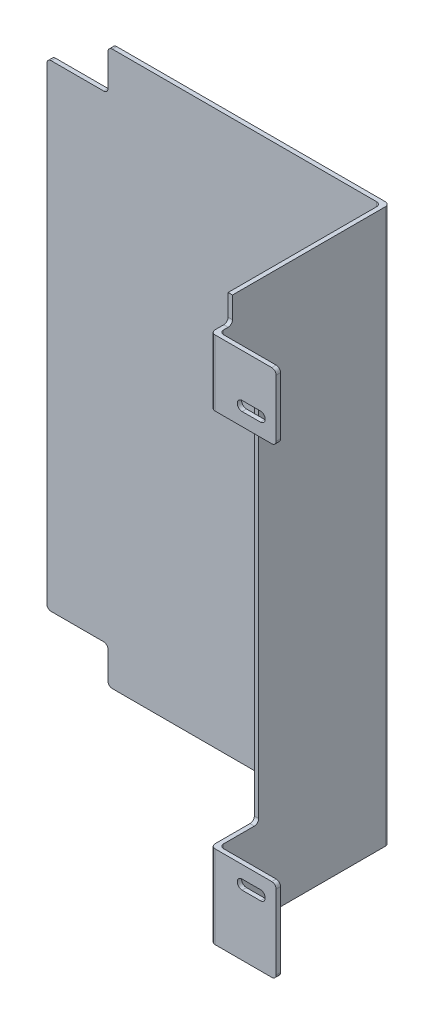
from build123d import *

# Parameters (mm, degrees)
SKETCH_1_W           = 77.5
SKETCH_1_H           = 127
EXTRUDE_1_DEPTH      = 1
SKETCH_3_W           = 1
SKETCH_3_H           = 127
EXTRUDE_3_DEPTH      = 39
SKETCH_8_W           = 15
SKETCH_8_H           = 127
EXTRUDE_4_DEPTH      = 1
SKETCH_21_W          = 14
SKETCH_21_H          = 8.4
SKETCH_21_H_2        = 9.4
CUT_EXTRUDE_6_DEPTH  = 10
SKETCH_23_W          = 103.043783305
SKETCH_23_H          = 23.177469884
SKETCH_23_W_2        = 105.258191256
SKETCH_23_H_2        = 21.258316326
CUT_EXTRUDE_7_DEPTH  = 100
SKETCH_24_W          = 15
SKETCH_24_H          = 86.8
CUT_EXTRUDE_8_DEPTH  = 10
SKETCH_25_W          = 15
SKETCH_25_H          = 6
CUT_EXTRUDE_9_DEPTH  = 4
CUT_EXTRUDE_10_DEPTH = 3
FILLET_4_R           = 1
SKETCH_27_W          = 6.001854857
SKETCH_27_H          = 0.706005101
SKETCH_27_W_2        = 0.785532112
SKETCH_27_H_2        = 5.586366798
SKETCH_27_W_3        = 0.26923077
SKETCH_27_H_3        = 3
SKETCH_27_W_4        = 0.269230769
CUT_EXTRUDE_11_DEPTH = 0.2


with BuildPart() as part:
    # 草图1 → 凸台-拉伸1 (new body)
    with BuildSketch(Plane.XY):
        with Locations((-106.368181818, 6.802865707)):
            Rectangle(SKETCH_1_W, SKETCH_1_H)
    extrude(amount=EXTRUDE_1_DEPTH)

    # 草图3 → 凸台-拉伸3 (add)
    with BuildSketch(Plane.XY.offset(1)):
        with Locations((-68.118181818, 6.802865707)):
            Rectangle(SKETCH_3_W, SKETCH_3_H)
    extrude(amount=EXTRUDE_3_DEPTH)

    # 草图8 → 凸台-拉伸4 (add)
    with BuildSketch(Plane.XY.offset(40)):
        with Locations((-61.118181818, 6.802865707)):
            Rectangle(SKETCH_8_W, SKETCH_8_H)
    extrude(amount=-EXTRUDE_4_DEPTH)

    # 草图21 → 切除-拉伸6 (cut)
    with BuildSketch(Plane(origin=(0, 0, 0), x_dir=(-1, 0, 0), z_dir=(0, 0, -1))):
        with Locations((138.118181818, -52.497134293)):
            Rectangle(SKETCH_21_W, SKETCH_21_H)
        with Locations((138.118181818, 65.602865707)):
            Rectangle(SKETCH_21_W, SKETCH_21_H_2)
    extrude(amount=-CUT_EXTRUDE_6_DEPTH, mode=Mode.SUBTRACT)

    # 草图23 → 切除-拉伸7 (cut)
    with BuildSketch(Plane(origin=(0, 0, 0), x_dir=(-1, 0, 0), z_dir=(0, 0, -1))):
        with Locations((104.846655458, -68.185869235)):
            Rectangle(SKETCH_23_W, SKETCH_23_H)
        with Locations((107.87301299, 80.83202387)):
            Rectangle(SKETCH_23_W_2, SKETCH_23_H_2)
    extrude(amount=-CUT_EXTRUDE_7_DEPTH, mode=Mode.SUBTRACT)

    # 草图24 → 切除-拉伸8 (cut)
    with BuildSketch(Plane.XY.offset(40)):
        with Locations((-61.118181818, 5.802865707)):
            Rectangle(SKETCH_24_W, SKETCH_24_H)
    extrude(amount=-CUT_EXTRUDE_8_DEPTH, mode=Mode.SUBTRACT)

    # 草图25 → 切除-拉伸9 (cut)
    with BuildSketch(Plane.XY.offset(40)):
        with Locations((-61.118181818, 67.302865707)):
            Rectangle(SKETCH_25_W, SKETCH_25_H)
    extrude(amount=-CUT_EXTRUDE_9_DEPTH, mode=Mode.SUBTRACT)

    # 草图26 → 切除-拉伸10 (cut)
    with BuildSketch(Plane(origin=(0, 0, 39), x_dir=(-1, 0, 0), z_dir=(0, 0, -1))):
        with BuildLine():
            Line((57.218181818, -40.497134293), (61.418181818, -40.497134293))
            ThreePointArc((61.418181818, -40.497134293), (62.518181818, -41.597134293), (61.418181818, -42.697134293))
            Line((61.418181818, -42.697134293), (57.218181818, -42.697134293))
            ThreePointArc((57.218181818, -42.697134293), (56.118181818, -41.597134293), (57.218181818, -40.497134293))
        make_face()
        with BuildLine():
            Line((57.218181818, 54.402865707), (61.418181818, 54.402865707))
            ThreePointArc((61.418181818, 54.402865707), (62.518181818, 53.302865707), (61.418181818, 52.202865707))
            Line((61.418181818, 52.202865707), (57.218181818, 52.202865707))
            ThreePointArc((57.218181818, 52.202865707), (56.118181818, 53.302865707), (57.218181818, 54.402865707))
        make_face()
    extrude(amount=-CUT_EXTRUDE_10_DEPTH, mode=Mode.SUBTRACT)

    # 圆角4
    fillet_4_edges = [part.edges().sort_by_distance(p)[0] for p in [
        (-53.618181818, -56.597134293, 39.5),
        (-53.618181818, 49.202865707, 39.5),
        (-53.618181818, -37.597134293, 39.5),
        (-67.618181818, -47.097134293, 39),
        (-68.618181818, -47.097134293, 40),
        (-68.118181818, -37.597134293, 30),
        (-68.118181818, 49.202865707, 30),
        (-53.618181818, 64.302865707, 39.5),
        (-67.618181818, 56.752865707, 39),
        (-68.618181818, 56.752865707, 40),
        (-68.118181818, 64.302865707, 36),
        (-145.118181818, -48.297134293, 0.5),
        (-131.118181818, -48.297134293, 0.5),
        (-145.118181818, 60.902865707, 0.5),
        (-131.118181818, 60.902865707, 0.5),
        (-131.118181818, -56.597134293, 0.5),
        (-131.118181818, 70.202865707, 0.5),
        (-68.618181818, 6.802865707, 1),
        (-67.618181818, 6.802865707, 0),
    ]]
    fillet(fillet_4_edges, radius=FILLET_4_R)

    # 草图27 → 切除-拉伸11 (cut)
    # profile 1 of 32: a face of its own
    with BuildSketch(Plane(origin=(0, 0, 0), x_dir=(-1, 0, 0), z_dir=(0, 0, -1))):
        with BuildLine():
            add(Edge.make_bspline(
                [(132.361810885, 6.932210097), (132.359718569, 6.836339908), (132.355567818, 6.646151987), (132.319557442, 6.36465751), (132.265765696, 6.088907514), (132.185210006, 5.821867786), (132.085678426, 5.562908953), (131.969075121, 5.31316953), (131.834613217, 5.072464954), (131.729598664, 4.92210297), (131.676904787, 4.846654799)],
                knots=[0, 0, 0, 0, 1.03058768, 2.044486723, 3.047426369, 4.048829226, 5.039629895, 6.028686707, 7.010840523, 8, 8, 8, 8], degree=3))
            Line((131.676904787, 4.846654799), (130.623577636, 4.846654799))
            add(Edge.make_bspline(
                [(130.623577636, 4.846654799), (130.699385171, 4.913654093), (130.849710902, 5.046513152), (131.04462651, 5.275246832), (131.214723968, 5.521414284), (131.357127515, 5.785965171), (131.47120739, 6.063667983), (131.549928523, 6.351615949), (131.601292479, 6.645267353), (131.607328865, 6.843813746), (131.610361777, 6.943571098)],
                knots=[0, 0, 0, 0, 1.013772945, 2.010303571, 3.005296295, 4.010536321, 5.018278058, 6.009712672, 7.000003016, 8, 8, 8, 8], degree=3))
            add(Edge.make_bspline(
                [(131.610361777, 6.943571098), (131.607549288, 7.036255633), (131.601993305, 7.219350978), (131.557763038, 7.489612377), (131.488854373, 7.752340535), (131.388603569, 8.004775564), (131.266498768, 8.246397747), (131.126139216, 8.47645509), (130.962128856, 8.688949348), (130.782542805, 8.88780058), (130.58337922, 9.06851012), (130.36789669, 9.230724171), (130.135327261, 9.373238687), (129.888280807, 9.49336745), (129.63078964, 9.594264394), (129.362645714, 9.663239723), (129.086963241, 9.707169181), (128.900117973, 9.712809056), (128.805817377, 9.715655494)],
                knots=[0, 0, 0, 0, 1.019271714, 2.013538798, 3.005469008, 4.002511789, 4.995441641, 5.981640173, 6.962633505, 7.944421105, 8.926208704, 9.916691219, 10.907960398, 11.922214128, 12.935908772, 13.945102014, 14.962895299, 16, 16, 16, 16], degree=3))
            add(Edge.make_bspline(
                [(128.805817377, 9.715655494), (128.711516035, 9.71281606), (128.524669292, 9.707190062), (128.248479575, 9.663075543), (127.979311809, 9.594158538), (127.720794677, 9.494228591), (127.4741149, 9.372291631), (127.240428428, 9.230919636), (127.023276966, 9.06806135), (126.821190187, 8.887800365), (126.637985395, 8.690034931), (126.474491083, 8.475856448), (126.331958251, 8.246894392), (126.209739121, 8.005072818), (126.111843883, 7.7519752), (126.042384186, 7.48965928), (125.99831304, 7.219338896), (125.992735417, 7.036251572), (125.989911974, 6.943571098)],
                knots=[0, 0, 0, 0, 1.034925094, 2.050579359, 3.063398465, 4.080510706, 5.087302685, 6.081558313, 7.074713255, 8.063256922, 9.051015066, 10.029946716, 11.017204657, 12.008047742, 13.000847364, 13.990692908, 14.982870414, 16, 16, 16, 16], degree=3))
            add(Edge.make_bspline(
                [(125.989911974, 6.943571098), (125.9926493, 6.843766722), (125.998102423, 6.64494289), (126.053981519, 6.351520374), (126.135185779, 6.063116405), (126.254872412, 5.786145096), (126.400246789, 5.522053011), (126.570180718, 5.276535319), (126.759761443, 5.048011016), (126.904282833, 4.913867958), (126.976696115, 4.846654799)],
                knots=[0, 0, 0, 0, 1.002243855, 1.996605469, 2.993240355, 4.009509462, 5.022221091, 6.019449441, 7.007633632, 8, 8, 8, 8], degree=3))
            Line((126.976696115, 4.846654799), (125.944467968, 4.846654799))
            add(Edge.make_bspline(
                [(125.944467968, 4.846654799), (125.891702232, 4.922068299), (125.78654447, 5.072361188), (125.652928723, 5.31398849), (125.531976378, 5.562361938), (125.43146796, 5.821885798), (125.34906144, 6.088814519), (125.293825194, 6.364607779), (125.255630195, 6.646036635), (125.251769361, 6.836323622), (125.249823869, 6.932210097)],
                knots=[0, 0, 0, 0, 0.987846152, 1.968695945, 2.961417013, 3.952998205, 4.95474104, 5.95751121, 6.97078065, 8, 8, 8, 8], degree=3))
            add(Edge.make_bspline(
                [(125.249823869, 6.932210097), (125.253325603, 7.052493022), (125.260251814, 7.290405066), (125.313360978, 7.641446831), (125.401777623, 7.981067813), (125.52305817, 8.308484564), (125.676628316, 8.619103955), (125.852470981, 8.912967981), (126.057314361, 9.182631968), (126.282992233, 9.432884716), (126.534298857, 9.658094862), (126.805437761, 9.862248193), (127.100004155, 10.039743658), (127.413824592, 10.191658625), (127.744087149, 10.315982503), (128.088079027, 10.40318144), (128.443279405, 10.456838288), (128.683903073, 10.463652245), (128.805817377, 10.467104602)],
                knots=[0, 0, 0, 0, 1.036567134, 2.050264442, 3.052428786, 4.057291306, 5.054233742, 6.035576434, 7.004653534, 7.968656631, 8.936116541, 9.908923092, 10.890265784, 11.89559352, 12.910823657, 13.926535674, 14.949459281, 16, 16, 16, 16], degree=3))
            add(Edge.make_bspline(
                [(128.805817377, 10.467104602), (128.927731716, 10.463652284), (129.168355454, 10.456838405), (129.523555314, 10.403180985), (129.867549137, 10.315984196), (130.197804462, 10.191652334), (130.511651422, 10.03976665), (130.806121588, 9.862164943), (131.07729294, 9.658643175), (131.327028145, 9.432300233), (131.552776373, 9.18271239), (131.757485885, 8.912933599), (131.9335257, 8.619160981), (132.086513675, 8.308117472), (132.210323549, 7.981444061), (132.298135244, 7.641394922), (132.351418654, 7.290418449), (132.358321143, 7.052497516), (132.361810885, 6.932210097)],
                knots=[0, 0, 0, 0, 1.0506605, 2.07370074, 3.089528567, 4.10487446, 5.110316822, 6.091771406, 7.064688875, 8.028801887, 8.992914898, 9.96210249, 10.943557074, 11.940613181, 12.947223179, 13.949501789, 14.963314678, 16, 16, 16, 16], degree=3))
        make_face()
    # profile 2 of 32: a face of its own
    with BuildSketch(Plane(origin=(0, 0, 0), x_dir=(-1, 0, 0), z_dir=(0, 0, -1))):
        with BuildLine():
            add(Edge.make_bspline(
                [(128.805817377, 3.398938592), (128.70455715, 3.401686356), (128.504117503, 3.40712542), (128.207895303, 3.442810221), (127.920712656, 3.504982439), (127.643132715, 3.591494233), (127.374783006, 3.699013024), (127.116030519, 3.825986126), (126.866638047, 3.972285682), (126.708708672, 4.083273049), (126.629374066, 4.139026698)],
                knots=[0, 0, 0, 0, 1.039063368, 2.05677492, 3.056337236, 4.050179329, 5.036722986, 6.019887094, 7.005305522, 8, 8, 8, 8], degree=3))
            Line((126.629374066, 4.139026698), (130.982260687, 4.139026698))
            add(Edge.make_bspline(
                [(130.982260687, 4.139026698), (130.906256466, 4.083190237), (130.754328162, 3.97157619), (130.511199561, 3.82533091), (130.255940785, 3.698748729), (129.989156135, 3.591275167), (129.710550094, 3.504285402), (129.419382518, 3.442757124), (129.116163137, 3.406991851), (128.910324416, 3.401650478), (128.805817377, 3.398938592)],
                knots=[0, 0, 0, 0, 0.966144402, 1.931270101, 2.903251329, 3.883405307, 4.875994212, 5.890560788, 6.929009833, 8, 8, 8, 8], degree=3))
        make_face()
    # profile 3 of 32: a face of its own
    with BuildSketch(Plane(origin=(0, 0, 0), x_dir=(-1, 0, 0), z_dir=(0, 0, -1))):
        Polygon((115.209944434, 10.433021597), (117.800252804, 5.047906828), (119.247969011, 8.110508265), (120.716784221, 5.047906828), (123.251910583, 10.433021597), (124.116969707, 10.433021597), (121.490955332, 4.846654799), (119.932875109, 4.846654799), (119.247969011, 6.271649002), (118.585784917, 4.846654799), (117.037442695, 4.846654799), (114.344885311, 10.433021597), align=None)
    # profile 4 of 32: a face of its own
    with BuildSketch(Plane(origin=(0, 0, 0), x_dir=(-1, 0, 0), z_dir=(0, 0, -1))):
        Polygon((121.154994284, 4.139026698), (120.716784221, 3.220408567), (120.280197159, 4.139026698), align=None)
    # profile 5 of 32: a face of its own
    with BuildSketch(Plane(origin=(0, 0, 0), x_dir=(-1, 0, 0), z_dir=(0, 0, -1))):
        Polygon((118.249823869, 4.139026698), (117.822974808, 3.220408567), (117.384764745, 4.139026698), align=None)
    # profile 6 of 32: a face of its own
    with BuildSketch(Plane(origin=(0, 0, 0), x_dir=(-1, 0, 0), z_dir=(0, 0, -1))):
        Polygon((113.137373138, 9.727016496), (110.534080766, 9.727016496), (110.534080766, 4.846654799), (109.748548654, 4.846654799), (109.748548654, 9.727016496), (107.135518281, 9.727016496), (107.135518281, 10.433021597), (113.137373138, 10.433021597), align=None)
    # profile 7 of 32: a face of its own
    with BuildSketch(Plane(origin=(0, 0, 0), x_dir=(-1, 0, 0), z_dir=(0, 0, -1))):
        with Locations((110.13644571, 3.786024148)):
            Rectangle(SKETCH_27_W, SKETCH_27_H)
    # profile 8 of 32: a face of its own
    with BuildSketch(Plane(origin=(0, 0, 0), x_dir=(-1, 0, 0), z_dir=(0, 0, -1))):
        Polygon((100.330278309, 10.433021597), (104.301759876, 4.846654799), (103.324713736, 4.846654799), (99.880707244, 9.770837502), (99.880707244, 4.846654799), (99.095175132, 4.846654799), (99.095175132, 10.433021597), align=None)
    # profile 9 of 32: a face of its own
    with BuildSketch(Plane(origin=(0, 0, 0), x_dir=(-1, 0, 0), z_dir=(0, 0, -1))):
        with Locations((105.231739009, 7.639838198)):
            Rectangle(SKETCH_27_W_2, SKETCH_27_H_2)
    # profile 10 of 32: a face of its own
    with BuildSketch(Plane(origin=(0, 0, 0), x_dir=(-1, 0, 0), z_dir=(0, 0, -1))):
        Polygon((104.838972953, 4.08384469), (104.838972953, 4.139026698), (105.624505065, 4.139026698), (105.624505065, 3.433021597), (104.311497877, 3.433021597), (103.818105807, 4.139026698), (104.806512948, 4.139026698), align=None)
    # profile 11 of 32: a face of its own
    with BuildSketch(Plane(origin=(0, 0, 0), x_dir=(-1, 0, 0), z_dir=(0, 0, -1))):
        with Locations((99.487941188, 3.786024148)):
            Rectangle(SKETCH_27_W_2, SKETCH_27_H)
    # profile 12 of 32: a face of its own
    with BuildSketch(Plane(origin=(0, 0, 0), x_dir=(-1, 0, 0), z_dir=(0, 0, -1))):
        Polygon((97.556570912, 9.727016496), (94.95327854, 9.727016496), (94.95327854, 4.846654799), (94.167746428, 4.846654799), (94.167746428, 9.727016496), (91.554716055, 9.727016496), (91.554716055, 10.433021597), (97.556570912, 10.433021597), align=None)
    # profile 13 of 32: a face of its own
    with BuildSketch(Plane(origin=(0, 0, 0), x_dir=(-1, 0, 0), z_dir=(0, 0, -1))):
        with Locations((94.555643484, 3.786024148)):
            Rectangle(SKETCH_27_W, SKETCH_27_H)
    # profile 14 of 32: a face of its own
    with BuildSketch(Plane(origin=(0, 0, 0), x_dir=(-1, 0, 0), z_dir=(0, 0, -1))):
        with BuildLine():
            Line((90.020980836, 9.727016496), (85.994317261, 9.727016496))
            add(Edge.make_bspline(
                [(85.994317261, 9.727016496), (85.945576825, 9.72625712), (85.850512015, 9.724776009), (85.712549163, 9.708222612), (85.583926713, 9.681593338), (85.465480103, 9.641084442), (85.355032309, 9.593946195), (85.254760611, 9.532994577), (85.165124676, 9.460606096), (85.057128742, 9.352836519), (84.94525472, 9.19632099), (84.850445097, 8.982540351), (84.7922934, 8.744900982), (84.785471749, 8.578275364), (84.781936087, 8.49191332)],
                knots=[0, 0, 0, 0, 0.894045037, 1.743772317, 2.546064088, 3.299570562, 4.037479179, 4.745807551, 5.44510245, 6.147140658, 7.541353896, 8.94560581, 10.416907733, 12, 12, 12, 12], degree=3))
            add(Edge.make_bspline(
                [(84.781936087, 8.49191332), (84.784032021, 8.416502013), (84.788061702, 8.271514829), (84.829869685, 8.064329463), (84.895940611, 7.877181014), (84.989085047, 7.709554436), (85.113625242, 7.564591985), (85.275189633, 7.45270016), (85.464252575, 7.362008469), (85.605484997, 7.330249075), (85.679455216, 7.313615151)],
                knots=[0, 0, 0, 0, 1.107947277, 2.130160098, 3.094221819, 4.017106281, 4.936381347, 5.877172391, 6.888172984, 8, 8, 8, 8], degree=3))
            Line((85.679455216, 7.313615151), (85.679455216, 6.573527046))
            add(Edge.make_bspline(
                [(85.679455216, 6.573527046), (85.622543696, 6.575448459), (85.509050909, 6.579280137), (85.341320369, 6.608626639), (85.179228691, 6.660610344), (85.022401178, 6.728151146), (84.872577444, 6.813068094), (84.732644282, 6.912508963), (84.598796611, 7.021180888), (84.478283769, 7.14565549), (84.364461129, 7.279212063), (84.268905283, 7.429068024), (84.178927269, 7.586150307), (84.107422178, 7.756630252), (84.048924659, 7.934051444), (84.006779724, 8.117096942), (83.979586671, 8.303366862), (83.976732205, 8.4290645), (83.975304972, 8.49191332)],
                knots=[0, 0, 0, 0, 0.962596373, 1.919606864, 2.869103692, 3.836561256, 4.803802322, 5.776312143, 6.738429753, 7.715708597, 8.703601777, 9.701241016, 10.717350462, 11.762918456, 12.822256561, 13.874612732, 14.937306366, 16, 16, 16, 16], degree=3))
            add(Edge.make_bspline(
                [(83.975304972, 8.49191332), (83.976444975, 8.563441871), (83.978682234, 8.703816945), (84.008549485, 8.908170731), (84.049097403, 9.103943415), (84.111364856, 9.28777383), (84.188054428, 9.460745127), (84.276514264, 9.620529374), (84.376877072, 9.76740041), (84.488879651, 9.900628868), (84.612179746, 10.020242297), (84.744476013, 10.127501893), (84.887703817, 10.217868025), (85.03933139, 10.29441864), (85.197733684, 10.356649228), (85.362367686, 10.399452143), (85.530675358, 10.429398942), (85.644698597, 10.431807469), (85.702177219, 10.433021597)],
                knots=[0, 0, 0, 0, 1.184646847, 2.324874281, 3.417261675, 4.494935235, 5.534817173, 6.550479279, 7.518127336, 8.479228562, 9.430530745, 10.36192561, 11.297370225, 12.231868599, 13.17450773, 14.11209934, 15.04831744, 16, 16, 16, 16], degree=3))
            Line((85.702177219, 10.433021597), (90.020980836, 10.433021597))
            Line((90.020980836, 10.433021597), (90.020980836, 9.727016496))
        make_face()
    # profile 15 of 32: a face of its own
    with BuildSketch(Plane(origin=(0, 0, 0), x_dir=(-1, 0, 0), z_dir=(0, 0, -1))):
        with BuildLine():
            Line((84.087291988, 4.139026698), (89.774284801, 4.139026698))
            add(Edge.make_bspline(
                [(89.774284801, 4.139026698), (89.733909994, 4.084941776), (89.654135185, 3.978077752), (89.512684931, 3.837259685), (89.355708697, 3.717305196), (89.186957628, 3.614550025), (89.006413889, 3.532300151), (88.814382507, 3.476648987), (88.613711511, 3.438653622), (88.476065983, 3.434919693), (88.406095605, 3.433021597)],
                knots=[0, 0, 0, 0, 1.010118382, 1.99584856, 2.978241117, 3.963738029, 4.950434005, 5.940220839, 6.9529371, 8, 8, 8, 8], degree=3))
            Line((88.406095605, 3.433021597), (84.087291988, 3.433021597))
            Line((84.087291988, 3.433021597), (84.087291988, 4.139026698))
        make_face()
    # profile 16 of 32: a face of its own
    with BuildSketch(Plane(origin=(0, 0, 0), x_dir=(-1, 0, 0), z_dir=(0, 0, -1))):
        with BuildLine():
            add(Edge.make_bspline(
                [(90.132967852, 5.374129874), (90.132191424, 5.329214522), (90.130637387, 5.239315451), (90.12284396, 5.105484611), (90.108221471, 4.973707976), (90.087856045, 4.888692736), (90.077785844, 4.846654799)],
                knots=[0, 0, 0, 0, 1.013661509, 2.028865938, 3.025322871, 4, 4, 4, 4], degree=3))
            Line((90.077785844, 4.846654799), (89.246809725, 4.846654799))
            add(Edge.make_bspline(
                [(89.246809725, 4.846654799), (89.258863289, 4.882703075), (89.284249692, 4.958625526), (89.309875101, 5.083132937), (89.323799615, 5.223405516), (89.325461953, 5.322161083), (89.326336737, 5.374129874)],
                knots=[0, 0, 0, 0, 0.850057133, 1.790333072, 2.837192447, 4, 4, 4, 4], degree=3))
            add(Edge.make_bspline(
                [(89.326336737, 5.374129874), (89.324192686, 5.449533117), (89.320055387, 5.595036094), (89.278654989, 5.802839746), (89.21192419, 5.991657513), (89.117836713, 6.160126396), (88.994352253, 6.308181063), (88.83405828, 6.423439685), (88.643906712, 6.513590513), (88.502748802, 6.545469489), (88.428817608, 6.562166044)],
                knots=[0, 0, 0, 0, 1.103013834, 2.128446887, 3.088215855, 4.024683736, 4.940688048, 5.886624871, 6.893123703, 8, 8, 8, 8], degree=3))
            Line((88.428817608, 6.562166044), (88.428817608, 7.292516148))
            add(Edge.make_bspline(
                [(88.428817608, 7.292516148), (88.486285264, 7.290681637), (88.5998167, 7.28705743), (88.76788218, 7.256848291), (88.929843918, 7.206159169), (89.086296275, 7.137525644), (89.235100163, 7.052708657), (89.376726837, 6.955502049), (89.508805094, 6.844608654), (89.630287426, 6.720643621), (89.742946812, 6.586424388), (89.841620225, 6.439697541), (89.928850884, 6.282586802), (90.00098775, 6.114396833), (90.059546213, 5.937997695), (90.101648487, 5.754919355), (90.128822978, 5.566460883), (90.131578424, 5.4386023), (90.132967852, 5.374129874)],
                knots=[0, 0, 0, 0, 0.971398133, 1.919066005, 2.876969733, 3.835703325, 4.80260982, 5.769559602, 6.737201732, 7.714142532, 8.701693997, 9.696466754, 10.699786402, 11.736589288, 12.786869172, 13.83886133, 14.910250314, 16, 16, 16, 16], degree=3))
        make_face()
    # profile 17 of 32: a face of its own
    with BuildSketch(Plane(origin=(0, 0, 0), x_dir=(-1, 0, 0), z_dir=(0, 0, -1))):
        with BuildLine():
            add(Edge.make_bspline(
                [(131.212811437, 24.895309635), (131.157255587, 24.896692945), (131.048139313, 24.899409878), (130.887920707, 24.920893799), (130.734504939, 24.956255053), (130.587800378, 25.006189306), (130.448377592, 25.070934976), (130.315795786, 25.149537674), (130.190510681, 25.242769907), (130.072846316, 25.348418505), (129.965900787, 25.464548388), (129.872840846, 25.589221997), (129.793638157, 25.719930003), (129.728926729, 25.857523622), (129.678078726, 26.00138854), (129.643010884, 26.15238179), (129.620605219, 26.309500688), (129.617986192, 26.416666727), (129.616657591, 26.471030789)],
                knots=[0, 0, 0, 0, 1.065027606, 2.091802087, 3.093458616, 4.079833113, 5.057734272, 6.036020118, 7.030157768, 8.047461502, 9.064242947, 10.052216774, 11.02588392, 11.989864716, 12.962978571, 13.945936472, 14.957997893, 16, 16, 16, 16], degree=3))
            add(Edge.make_bspline(
                [(129.616657591, 26.471030789), (129.617986637, 26.524994082), (129.620606341, 26.631361982), (129.643029089, 26.787488278), (129.678235111, 26.937553743), (129.728297692, 27.081209345), (129.793056787, 27.218525619), (129.872384102, 27.349325077), (129.965234965, 27.474362221), (130.071742013, 27.591057416), (130.18804858, 27.69801281), (130.311951923, 27.792562987), (130.443302528, 27.871328705), (130.580050334, 27.937007513), (130.723556285, 27.986750437), (130.872808271, 28.022999007), (131.028652562, 28.045178868), (131.134813824, 28.047815602), (131.188772976, 28.049155789)],
                knots=[0, 0, 0, 0, 1.043683505, 2.0572211, 3.045299494, 4.022276905, 4.994977706, 5.977452478, 6.97747046, 8.003698437, 9.029677512, 10.031249186, 11.013723958, 11.988083691, 12.9614021, 13.946617861, 14.956316495, 16, 16, 16, 16], degree=3))
            add(Edge.make_bspline(
                [(131.188772976, 28.049155789), (131.243136784, 28.047827922), (131.350302322, 28.045210341), (131.507618256, 28.022766581), (131.658719055, 27.987683407), (131.80313948, 27.937498179), (131.940926925, 27.872883834), (132.072068062, 27.793482398), (132.196720481, 27.699918712), (132.313615696, 27.593495304), (132.42044212, 27.477411762), (132.514402129, 27.353671106), (132.593345799, 27.223450182), (132.657987421, 27.087285783), (132.709116483, 26.945529873), (132.744009558, 26.797290753), (132.766582355, 26.643399088), (132.769183772, 26.538619552), (132.770503745, 26.485453866)],
                knots=[0, 0, 0, 0, 1.053167129, 2.076072758, 3.073341244, 4.055601477, 5.033424535, 6.017524495, 7.021518915, 8.049444456, 9.077120685, 10.074910483, 11.055688766, 12.022980584, 12.991883888, 13.970269434, 14.970104079, 16, 16, 16, 16], degree=3))
            add(Edge.make_bspline(
                [(132.770503745, 26.485453866), (132.770045906, 26.449768558), (132.769136005, 26.378848128), (132.758165514, 26.273536299), (132.742278657, 26.169906742), (132.719391202, 26.068307808), (132.689868327, 25.968722907), (132.653486393, 25.871355696), (132.611792682, 25.775404155), (132.562150559, 25.682694411), (132.507989518, 25.593080952), (132.448932345, 25.507684317), (132.384567264, 25.428029922), (132.315813718, 25.352837848), (132.241720001, 25.283391453), (132.163401224, 25.218176646), (132.080447585, 25.157868506), (131.992727892, 25.103733671), (131.902478591, 25.054010167), (131.809044921, 25.012495133), (131.714398236, 24.97580141), (131.617704852, 24.946640782), (131.519188437, 24.92343458), (131.418725835, 24.907666552), (131.31642052, 24.896671685), (131.247496391, 24.895765605), (131.212811437, 24.895309635)],
                knots=[0, 0, 0, 0, 1.037115869, 2.061148057, 3.07517727, 4.084041727, 5.086514338, 6.092668487, 7.104487461, 8.125783165, 9.147610153, 10.147694368, 11.141876323, 12.122903372, 13.107606018, 14.091946891, 15.084523921, 16.086505767, 17.087268121, 18.077809654, 19.05670789, 20.036870126, 21.011670792, 21.99694167, 22.991993299, 24, 24, 24, 24], degree=3))
        make_face()
        with BuildLine():
            add(Edge.make_bspline(
                [(131.199590284, 25.203001943), (131.228060399, 25.203347615), (131.284728453, 25.204035655), (131.368965993, 25.213155193), (131.452125838, 25.226047036), (131.534025288, 25.244818438), (131.614737584, 25.268870538), (131.694352316, 25.298571439), (131.772940579, 25.333245229), (131.849783724, 25.373493706), (131.923654536, 25.418608071), (131.994996876, 25.466173591), (132.061086094, 25.518886214), (132.123198724, 25.574791167), (132.181184074, 25.634658182), (132.23504989, 25.698046243), (132.284743104, 25.765242324), (132.329668065, 25.83596645), (132.369647648, 25.909824675), (132.405443079, 25.9854049), (132.435116117, 26.063595416), (132.458621586, 26.143908274), (132.478572343, 26.225989557), (132.491086935, 26.310286472), (132.500293847, 26.396508419), (132.500944087, 26.454778911), (132.501272976, 26.484251943)],
                knots=[0, 0, 0, 0, 1.008431664, 2.007222653, 2.999229743, 3.989431819, 4.982149843, 5.98167215, 6.998687425, 8.024288174, 9.053028776, 10.065052016, 11.06063401, 12.045759335, 13.024701188, 14.011819507, 14.991481775, 15.984022113, 16.97831254, 17.965966747, 18.945551853, 19.938269878, 20.93007375, 21.936103907, 22.956087853, 24, 24, 24, 24], degree=3))
            add(Edge.make_bspline(
                [(132.501272976, 26.484251943), (132.500177737, 26.527590004), (132.498023063, 26.612849377), (132.47923796, 26.737807559), (132.450072231, 26.85801458), (132.407787434, 26.972753959), (132.353844832, 27.082537351), (132.288045808, 27.186937518), (132.209787782, 27.285923664), (132.120945822, 27.378758935), (132.023799481, 27.463459632), (131.920693806, 27.53791199), (131.81244453, 27.60057317), (131.699675575, 27.652956509), (131.581424139, 27.692419937), (131.458448404, 27.720557343), (131.330745653, 27.738793996), (131.243723629, 27.740565209), (131.199590284, 27.741463482)],
                knots=[0, 0, 0, 0, 1.032022337, 2.030307203, 3.003823408, 3.974715386, 4.937372378, 5.913284036, 6.909147208, 7.938749767, 8.970518239, 9.975863271, 10.963918693, 11.946286286, 12.933361397, 13.927862637, 14.949112547, 16, 16, 16, 16], degree=3))
            add(Edge.make_bspline(
                [(131.199590284, 27.741463482), (131.169924879, 27.741056236), (131.111089472, 27.740248547), (131.023580747, 27.732101988), (130.937640385, 27.71906425), (130.85342745, 27.70019953), (130.77083058, 27.676902996), (130.690102807, 27.648001551), (130.611256675, 27.613372366), (130.533958246, 27.574717364), (130.4598818, 27.53112177), (130.389868559, 27.483220897), (130.323458101, 27.432297329), (130.261458843, 27.376797236), (130.203715571, 27.317435229), (130.150812459, 27.253778982), (130.101142415, 27.187086283), (130.05653255, 27.116380133), (130.016004525, 27.043106324), (129.981260635, 26.967306075), (129.951570546, 26.88945948), (129.9276416, 26.809489716), (129.908879993, 26.727581918), (129.895955064, 26.643617444), (129.886913352, 26.557766689), (129.886231883, 26.499700512), (129.88588836, 26.470429828)],
                knots=[0, 0, 0, 0, 1.047362266, 2.077233941, 3.100744636, 4.115120168, 5.122788643, 6.129711893, 7.140355774, 8.162227187, 9.180148637, 10.17298275, 11.156396779, 12.133377858, 13.108923632, 14.078087502, 15.054351192, 16.043448276, 17.028082865, 18.009331763, 18.985518559, 19.968016174, 20.954783108, 21.950335389, 22.966780876, 24, 24, 24, 24], degree=3))
            add(Edge.make_bspline(
                [(129.88588836, 26.470429828), (129.886232172, 26.441359396), (129.886914184, 26.383692838), (129.895950591, 26.298440708), (129.908894211, 26.215080813), (129.927547961, 26.13394041), (129.951590949, 26.054998816), (129.981237236, 25.97833018), (130.016196052, 25.903648852), (130.056317433, 25.831139522), (130.101416539, 25.761560923), (130.150697955, 25.695045504), (130.205008734, 25.632836809), (130.26281136, 25.573420118), (130.32549552, 25.517983839), (130.393072206, 25.466742355), (130.46385865, 25.417386181), (130.539456392, 25.37370751), (130.617193849, 25.333160454), (130.697042929, 25.298596376), (130.778005123, 25.268738611), (130.860188568, 25.244922026), (130.943451295, 25.226028801), (131.027816441, 25.213159864), (131.11325268, 25.204034675), (131.170719756, 25.20334728), (131.199590284, 25.203001943)],
                knots=[0, 0, 0, 0, 1.02988216, 2.042960975, 3.035124439, 4.018561492, 4.99104521, 5.957523397, 6.929462691, 7.91146347, 8.892205782, 9.866320947, 10.842813644, 11.816825305, 12.802668543, 13.805243666, 14.821427616, 15.858893029, 16.897256944, 17.927432741, 18.940436917, 19.95373962, 20.957947499, 21.96413624, 22.977215056, 24, 24, 24, 24], degree=3))
        make_face(mode=Mode.SUBTRACT)
    # profile 18 of 32: a face of its own
    with BuildSketch(Plane(origin=(0, 0, 0), x_dir=(-1, 0, 0), z_dir=(0, 0, -1))):
        Polygon((129.347426822, 25.27992502), (129.347426822, 24.972232712), (127.770503745, 24.972232712), (127.770503745, 25.27992502), (128.424349899, 25.27992502), (128.424349899, 27.972232712), (128.693580668, 27.972232712), (128.693580668, 25.27992502), align=None)
    # profile 19 of 32: a face of its own
    with BuildSketch(Plane(origin=(0, 0, 0), x_dir=(-1, 0, 0), z_dir=(0, 0, -1))):
        Polygon((126.001272976, 24.972232712), (124.616657591, 27.972232712), (124.90932586, 27.972232712), (125.352835476, 27.010694251), (126.712811437, 27.010694251), (127.168941245, 27.972232712), (127.462811437, 27.972232712), (126.039734514, 24.972232712), align=None)
        Polygon((126.023508553, 25.556968289), (126.566777784, 26.703001943), (125.494662399, 26.703001943), align=None, mode=Mode.SUBTRACT)
    # profile 20 of 32: a face of its own
    with BuildSketch(Plane(origin=(0, 0, 0), x_dir=(-1, 0, 0), z_dir=(0, 0, -1))):
        Polygon((124.15511913, 24.972232712), (123.88588836, 24.972232712), (123.88588836, 26.114660597), (122.635287399, 24.972232712), (122.251272976, 24.972232712), (123.72543163, 26.318386559), (122.13588836, 27.972232712), (122.494662399, 27.972232712), (123.88588836, 26.524516366), (123.88588836, 27.972232712), (124.15511913, 27.972232712), align=None)
    # profile 21 of 32: a face of its own
    with BuildSketch(Plane(origin=(0, 0, 0), x_dir=(-1, 0, 0), z_dir=(0, 0, -1))):
        with BuildLine():
            Line((121.693580668, 24.972232712), (121.424349899, 24.972232712))
            Line((121.424349899, 24.972232712), (121.424349899, 26.769708674))
            add(Edge.make_bspline(
                [(121.424349899, 26.769708674), (121.424389965, 26.795149305), (121.424465998, 26.843427285), (121.423958129, 26.912142972), (121.422535813, 26.973233651), (121.421639105, 27.026934806), (121.419644248, 27.073000018), (121.41801735, 27.111678856), (121.415925444, 27.142788172), (121.413411344, 27.160943251), (121.412330668, 27.168747135)],
                knots=[0, 0, 0, 0, 1.528628734, 2.90083645, 4.128790002, 5.200304208, 6.127813768, 6.898992206, 7.526736466, 8, 8, 8, 8], degree=3))
            add(Edge.make_bspline(
                [(121.412330668, 27.168747135), (121.407947757, 27.197119864), (121.399486745, 27.251892141), (121.376926154, 27.329792169), (121.347095115, 27.400371878), (121.309078064, 27.464419852), (121.262188917, 27.522386418), (121.204337017, 27.574828884), (121.135641768, 27.621898332), (121.05766517, 27.663186604), (120.974529654, 27.697430243), (120.889277469, 27.72306588), (120.803537157, 27.738752059), (120.746127598, 27.740563804), (120.71761913, 27.741463482)],
                knots=[0, 0, 0, 0, 1.042923073, 2.013316119, 2.939979093, 3.821796737, 4.712412725, 5.640305549, 6.650442997, 7.732186751, 8.842579391, 9.91407549, 10.964170509, 12, 12, 12, 12], degree=3))
            add(Edge.make_bspline(
                [(120.71761913, 27.741463482), (120.693142299, 27.740548192), (120.644330009, 27.738722898), (120.571842919, 27.72727921), (120.501018377, 27.707065733), (120.43242805, 27.679516369), (120.367129754, 27.645692021), (120.306879075, 27.604890662), (120.252310511, 27.558056887), (120.203099882, 27.505410102), (120.160266537, 27.446627691), (120.123393516, 27.382015913), (120.093266306, 27.311059431), (120.078131472, 27.261053312), (120.070383553, 27.235453866)],
                knots=[0, 0, 0, 0, 0.994543961, 1.983343699, 2.972712664, 3.980751554, 4.981834161, 5.954730495, 6.930176574, 7.89761099, 8.875938748, 9.87834379, 10.913868493, 12, 12, 12, 12], degree=3))
            add(Edge.make_bspline(
                [(120.070383553, 27.235453866), (120.067812017, 27.224869374), (120.062081598, 27.20128286), (120.056726988, 27.161407468), (120.051149967, 27.114359441), (120.047280335, 27.059800745), (120.043507861, 26.997914197), (120.041250941, 26.928377405), (120.04020777, 26.851442867), (120.039896901, 26.797753871), (120.039734514, 26.769708674)],
                knots=[0, 0, 0, 0, 0.558680831, 1.244966039, 2.062412453, 2.990489873, 4.051219941, 5.244515665, 6.560634259, 8, 8, 8, 8], degree=3))
            Line((120.039734514, 26.769708674), (120.039734514, 24.972232712))
            Line((120.039734514, 24.972232712), (119.770503745, 24.972232712))
            Line((119.770503745, 24.972232712), (119.770503745, 26.784131751))
            add(Edge.make_bspline(
                [(119.770503745, 26.784131751), (119.770719185, 26.81678785), (119.771139629, 26.880518213), (119.774858866, 26.97390029), (119.780619612, 27.062505524), (119.789321624, 27.146222454), (119.798950326, 27.225145295), (119.81261039, 27.298984974), (119.827137487, 27.368367911), (119.845368795, 27.433422083), (119.867055953, 27.495129073), (119.892882248, 27.554654402), (119.924337207, 27.611462509), (119.959942203, 27.66659479), (120.00042622, 27.719543161), (120.045444059, 27.770718493), (120.095716248, 27.819448017), (120.149975783, 27.8659647), (120.207782133, 27.90953137), (120.269783832, 27.946624815), (120.334871036, 27.978017562), (120.402353455, 28.00475556), (120.473371643, 28.024307779), (120.547040995, 28.038987271), (120.623879264, 28.047291495), (120.67613404, 28.04852909), (120.702595091, 28.049155789)],
                knots=[0, 0, 0, 0, 1.316485072, 2.56920066, 3.767172097, 4.895413872, 5.962239305, 6.971350037, 7.921780903, 8.819233545, 9.69278517, 10.557066787, 11.431700348, 12.307563454, 13.200791052, 14.11626757, 15.05287325, 16.020813301, 16.99640464, 17.967304965, 18.928075993, 19.907403966, 20.889159767, 21.893313923, 22.933205135, 24, 24, 24, 24], degree=3))
            add(Edge.make_bspline(
                [(120.702595091, 28.049155789), (120.731454533, 28.0484836), (120.788076654, 28.047164766), (120.871506298, 28.039595806), (120.951500774, 28.025375527), (121.028840808, 28.007151547), (121.102779209, 27.982427686), (121.173294187, 27.952048656), (121.241195402, 27.917366378), (121.304953056, 27.876383798), (121.365090172, 27.831695053), (121.419741061, 27.782609366), (121.47029304, 27.730996173), (121.51451789, 27.674911976), (121.554088342, 27.615504871), (121.588132441, 27.552495438), (121.617375133, 27.485968145), (121.6324661, 27.439722179), (121.640095091, 27.416343289)],
                knots=[0, 0, 0, 0, 1.138939089, 2.234594419, 3.301501784, 4.342532435, 5.367382236, 6.373123747, 7.370098489, 8.372230273, 9.360297234, 10.323289009, 11.268038109, 12.20748145, 13.137029304, 14.081414587, 15.030090602, 16, 16, 16, 16], degree=3))
            add(Edge.make_bspline(
                [(121.640095091, 27.416343289), (121.644532655, 27.400372511), (121.654157831, 27.365731538), (121.664465229, 27.308400262), (121.673130156, 27.242387475), (121.681277777, 27.16768866), (121.686085456, 27.084245917), (121.690300403, 26.992095418), (121.693610362, 26.891125736), (121.693590843, 26.820793294), (121.693580668, 26.784131751)],
                knots=[0, 0, 0, 0, 0.625038921, 1.35572334, 2.194682327, 3.136881307, 4.189498639, 5.346923369, 6.617055217, 8, 8, 8, 8], degree=3))
            Line((121.693580668, 26.784131751), (121.693580668, 24.972232712))
        make_face()
    # profile 22 of 32: a face of its own
    with BuildSketch(Plane(origin=(0, 0, 0), x_dir=(-1, 0, 0), z_dir=(0, 0, -1))):
        Polygon((132.770503745, 33.933771174), (132.374470091, 30.933771174), (132.336008553, 30.933771174), (131.097426822, 33.395309635), (129.861849899, 30.933771174), (129.822787399, 30.933771174), (129.424349899, 33.933771174), (129.694782591, 33.933771174), (129.982042207, 31.775117328), (131.064974899, 33.933771174), (131.125672014, 33.933771174), (132.212811437, 31.770309635), (132.499470091, 33.933771174), align=None)
    # profile 23 of 32: a face of its own
    with BuildSketch(Plane(origin=(0, 0, 0), x_dir=(-1, 0, 0), z_dir=(0, 0, -1))):
        with Locations((128.674349899, 32.433771174)):
            Rectangle(SKETCH_27_W_3, SKETCH_27_H_3)
    # profile 24 of 32: a face of its own
    with BuildSketch(Plane(origin=(0, 0, 0), x_dir=(-1, 0, 0), z_dir=(0, 0, -1))):
        Polygon((127.88588836, 33.933771174), (127.88588836, 30.933771174), (127.829397976, 30.933771174), (125.847426822, 33.294949059), (125.847426822, 30.933771174), (125.578196053, 30.933771174), (125.578196053, 33.933771174), (125.63949413, 33.933771174), (127.616657591, 31.578001943), (127.616657591, 33.933771174), align=None)
    # profile 25 of 32: a face of its own
    with BuildSketch(Plane(origin=(0, 0, 0), x_dir=(-1, 0, 0), z_dir=(0, 0, -1))):
        with Locations((124.674349899, 32.433771174)):
            Rectangle(SKETCH_27_W_3, SKETCH_27_H_3)
    # profile 26 of 32: a face of its own
    with BuildSketch(Plane(origin=(0, 0, 0), x_dir=(-1, 0, 0), z_dir=(0, 0, -1))):
        with BuildLine():
            Line((132.924349899, 39.316583674), (132.67074413, 39.164540405))
            add(Edge.make_bspline(
                [(132.67074413, 39.164540405), (132.647157069, 39.204024163), (132.601965172, 39.279673521), (132.526578292, 39.381894698), (132.448464368, 39.468776547), (132.36704494, 39.539813639), (132.282816984, 39.595741256), (132.195230652, 39.635343169), (132.1045811, 39.660042577), (132.042889253, 39.663042651), (132.012090284, 39.664540405)],
                knots=[0, 0, 0, 0, 1.272034388, 2.437168799, 3.508375237, 4.49857839, 5.41946034, 6.295179144, 7.148887113, 8, 8, 8, 8], degree=3))
            add(Edge.make_bspline(
                [(132.012090284, 39.664540405), (131.985792583, 39.663790401), (131.933657329, 39.662303516), (131.856755455, 39.648593673), (131.782441867, 39.626164471), (131.71145619, 39.595759001), (131.645675793, 39.558384985), (131.587076704, 39.514310794), (131.537564541, 39.463396023), (131.496631411, 39.407476448), (131.464588279, 39.347719338), (131.441788828, 39.285596352), (131.427142954, 39.221503353), (131.425286067, 39.17803962), (131.424349899, 39.156126943)],
                knots=[0, 0, 0, 0, 1.095645842, 2.172120455, 3.244862764, 4.326153987, 5.384857088, 6.392105572, 7.372507978, 8.334705661, 9.272564127, 10.189475455, 11.087205874, 12, 12, 12, 12], degree=3))
            add(Edge.make_bspline(
                [(131.424349899, 39.156126943), (131.425586452, 39.131140735), (131.428090608, 39.080540939), (131.450159897, 39.005759153), (131.483858778, 38.931434357), (131.515531939, 38.885451024), (131.531922014, 38.861655789)],
                knots=[0, 0, 0, 0, 0.938992559, 1.901562324, 2.914110574, 4, 4, 4, 4], degree=3))
            add(Edge.make_bspline(
                [(131.531922014, 38.861655789), (131.54531397, 38.844435494), (131.573511232, 38.808177519), (131.622700318, 38.755154051), (131.678631409, 38.699011986), (131.74275258, 38.640871907), (131.814128808, 38.579544516), (131.893569297, 38.516167202), (131.980146456, 38.449794717), (132.041211847, 38.4059576), (132.072787399, 38.383290405)],
                knots=[0, 0, 0, 0, 0.722283655, 1.520795216, 2.39349503, 3.346893347, 4.386874146, 5.510198126, 6.712579003, 8, 8, 8, 8], degree=3))
            add(Edge.make_bspline(
                [(132.072787399, 38.383290405), (132.104346614, 38.360803612), (132.16468543, 38.317810578), (132.249132931, 38.254084859), (132.324546339, 38.195450157), (132.391309924, 38.14272323), (132.447696428, 38.093604399), (132.495767182, 38.050726158), (132.533748676, 38.011798857), (132.554884482, 37.986566311), (132.564373937, 37.97523752)],
                knots=[0, 0, 0, 0, 1.452255772, 2.776602448, 3.96446981, 5.032613149, 5.964194703, 6.766668629, 7.446264616, 8, 8, 8, 8], degree=3))
            add(Edge.make_bspline(
                [(132.564373937, 37.97523752), (132.577633896, 37.957578612), (132.603711385, 37.922849999), (132.638171065, 37.868584041), (132.667231008, 37.813139681), (132.690618828, 37.756315979), (132.709531672, 37.698539996), (132.722680951, 37.639377975), (132.730785889, 37.579231542), (132.731623105, 37.538764228), (132.732042207, 37.518506751)],
                knots=[0, 0, 0, 0, 1.068019517, 2.100403715, 3.106014851, 4.09224787, 5.069873182, 6.043214339, 7.020455327, 8, 8, 8, 8], degree=3))
            add(Edge.make_bspline(
                [(132.732042207, 37.518506751), (132.730928386, 37.486764225), (132.728724552, 37.423957646), (132.709932583, 37.332256391), (132.680622172, 37.244434783), (132.638216725, 37.162447415), (132.585838065, 37.086410509), (132.523664495, 37.017672895), (132.450531681, 36.958600605), (132.369116183, 36.908384437), (132.281041395, 36.868323135), (132.188479957, 36.83913196), (132.091847792, 36.82202415), (132.026179815, 36.819611003), (131.992859514, 36.818386559)],
                knots=[0, 0, 0, 0, 1.005367131, 1.989245246, 2.955191616, 3.932180104, 4.904534562, 5.875498653, 6.859376768, 7.874484044, 8.900379497, 9.918679785, 10.943926428, 12, 12, 12, 12], degree=3))
            add(Edge.make_bspline(
                [(131.992859514, 36.818386559), (131.957496503, 36.819566587), (131.887367423, 36.821906726), (131.784180689, 36.843505015), (131.684239682, 36.877063118), (131.604144809, 36.917030172), (131.541435711, 36.956517558), (131.493663571, 36.992575465), (131.444989461, 37.033997248), (131.395937825, 37.081660412), (131.346024021, 37.134610388), (131.295478082, 37.193295774), (131.243826951, 37.25718761), (131.210609509, 37.302810562), (131.193580668, 37.326199059)],
                knots=[0, 0, 0, 0, 1.286534051, 2.551350862, 3.822568981, 5.117864672, 5.799956111, 6.519305446, 7.295594771, 8.126302591, 9.008831062, 9.944975596, 10.946496709, 12, 12, 12, 12], degree=3))
            Line((131.193580668, 37.326199059), (131.436970091, 37.510694251))
            add(Edge.make_bspline(
                [(131.436970091, 37.510694251), (131.451665533, 37.491759991), (131.479965518, 37.455297035), (131.522947905, 37.404250489), (131.563398441, 37.357558378), (131.603557009, 37.317109406), (131.640328058, 37.279874146), (131.676650767, 37.248561569), (131.711121937, 37.222177598), (131.754473271, 37.193984068), (131.809529587, 37.166706619), (131.877997313, 37.143254515), (131.949595254, 37.128841806), (131.998201515, 37.12700997), (132.022907591, 37.126078866)],
                knots=[0, 0, 0, 0, 1.181426797, 2.275151783, 3.28963443, 4.225459815, 5.084396437, 5.868484344, 6.587427557, 7.222918358, 8.415355282, 9.605213164, 10.782753814, 12, 12, 12, 12], degree=3))
            add(Edge.make_bspline(
                [(132.022907591, 37.126078866), (132.05390621, 37.12710046), (132.113684125, 37.129070506), (132.198353546, 37.151152541), (132.275000501, 37.184726787), (132.340699006, 37.233140499), (132.394945242, 37.29085897), (132.434671839, 37.35668282), (132.458423673, 37.429382702), (132.461330856, 37.480071545), (132.462811437, 37.505886559)],
                knots=[0, 0, 0, 0, 1.144248881, 2.206576175, 3.214949548, 4.222996039, 5.203671638, 6.127710127, 7.046472867, 8, 8, 8, 8], degree=3))
            add(Edge.make_bspline(
                [(132.462811437, 37.505886559), (132.462439299, 37.521951345), (132.461689837, 37.554304707), (132.452754431, 37.602006333), (132.439420211, 37.6491464), (132.420519322, 37.695996504), (132.394832791, 37.743891365), (132.359945972, 37.79255799), (132.316289738, 37.843214379), (132.282784728, 37.876128884), (132.265095091, 37.893506751)],
                knots=[0, 0, 0, 0, 0.858500039, 1.728959331, 2.587258638, 3.476905708, 4.426389682, 5.487945037, 6.673710648, 8, 8, 8, 8], degree=3))
            add(Edge.make_bspline(
                [(132.265095091, 37.893506751), (132.258528201, 37.899367059), (132.242926772, 37.913289809), (132.21440455, 37.936083192), (132.176739294, 37.964199854), (132.13091455, 37.998988982), (132.076085383, 38.039344521), (132.012245763, 38.084750475), (131.940107307, 38.136680868), (131.888917093, 38.172987332), (131.861849899, 38.192184635)],
                knots=[0, 0, 0, 0, 0.420754252, 0.999615792, 1.744751191, 2.668019286, 3.750313428, 4.999500688, 6.413464383, 8, 8, 8, 8], degree=3))
            add(Edge.make_bspline(
                [(131.861849899, 38.192184635), (131.829290568, 38.215877246), (131.766243935, 38.261754703), (131.676537128, 38.330682202), (131.595200642, 38.398095351), (131.521942893, 38.463559267), (131.456060303, 38.526592019), (131.398217006, 38.58790308), (131.348150553, 38.64709038), (131.293514337, 38.72245617), (131.238347955, 38.815874824), (131.191047316, 38.930381889), (131.16095546, 39.045217552), (131.157047358, 39.122301183), (131.15511913, 39.160333674)],
                knots=[0, 0, 0, 0, 1.163604038, 2.253157948, 3.268574773, 4.215621239, 5.091738613, 5.902582348, 6.650434646, 7.330118262, 8.591011492, 9.77460283, 10.902005569, 12, 12, 12, 12], degree=3))
            add(Edge.make_bspline(
                [(131.15511913, 39.160333674), (131.155683278, 39.187228918), (131.15680062, 39.24049712), (131.169611358, 39.318722985), (131.188447625, 39.39466542), (131.216520815, 39.467379356), (131.251613118, 39.537675195), (131.294337716, 39.605429682), (131.346115064, 39.669529538), (131.403633486, 39.731219601), (131.4675219, 39.787012164), (131.535128886, 39.836705723), (131.606074982, 39.879254457), (131.681170381, 39.912681688), (131.759178055, 39.939420614), (131.840464179, 39.958586373), (131.925203422, 39.970389265), (131.982804668, 39.97161137), (132.012090284, 39.972232712)],
                knots=[0, 0, 0, 0, 0.98378539, 1.948466333, 2.894822735, 3.844243623, 4.795447569, 5.768042124, 6.770299647, 7.807997672, 8.852593179, 9.870666288, 10.876941106, 11.874841786, 12.874492863, 13.892063892, 14.928283473, 16, 16, 16, 16], degree=3))
            add(Edge.make_bspline(
                [(132.012090284, 39.972232712), (132.034748149, 39.971789536), (132.079778527, 39.970908765), (132.146205126, 39.963306653), (132.211411926, 39.952158059), (132.274580199, 39.935160507), (132.336496429, 39.914052195), (132.396608989, 39.888208314), (132.455062888, 39.85744176), (132.511930333, 39.821704944), (132.567731822, 39.780508785), (132.622242147, 39.732943479), (132.675734185, 39.679236701), (132.728430136, 39.61946319), (132.77908868, 39.552634933), (132.828983727, 39.479811746), (132.877855474, 39.400758367), (132.908562284, 39.345165974), (132.924349899, 39.316583674)],
                knots=[0, 0, 0, 0, 0.915366252, 1.81920441, 2.69897508, 3.586533125, 4.459536084, 5.340758185, 6.227946952, 7.126403341, 8.052553006, 9.028121456, 10.047063623, 11.114014537, 12.24582441, 13.433687931, 14.680555077, 16, 16, 16, 16], degree=3))
        make_face()
    # profile 27 of 32: a face of its own
    with BuildSketch(Plane(origin=(0, 0, 0), x_dir=(-1, 0, 0), z_dir=(0, 0, -1))):
        Polygon((130.539734514, 36.895309635), (128.847426822, 36.895309635), (128.847426822, 37.203001943), (130.270503745, 37.203001943), (130.270503745, 38.126078866), (128.847426822, 38.126078866), (128.847426822, 38.433771174), (130.270503745, 38.433771174), (130.270503745, 39.587617328), (128.847426822, 39.587617328), (128.847426822, 39.895309635), (130.539734514, 39.895309635), align=None)
    # profile 28 of 32: a face of its own
    with BuildSketch(Plane(origin=(0, 0, 0), x_dir=(-1, 0, 0), z_dir=(0, 0, -1))):
        with BuildLine():
            Line((128.308965284, 36.895309635), (127.708604707, 36.895309635))
            add(Edge.make_bspline(
                [(127.708604707, 36.895309635), (127.668540882, 36.895442995), (127.591613901, 36.89569906), (127.481408241, 36.897126857), (127.381270729, 36.901219161), (127.291253724, 36.904740804), (127.211358877, 36.911162468), (127.141341199, 36.917300166), (127.081523173, 36.925334732), (127.045312443, 36.932796523), (127.028917207, 36.93617502)],
                knots=[0, 0, 0, 0, 1.410062039, 2.707475311, 3.878576406, 4.937260626, 5.877586885, 6.699081471, 7.410979367, 8, 8, 8, 8], degree=3))
            add(Edge.make_bspline(
                [(127.028917207, 36.93617502), (127.006968302, 36.941597361), (126.963538723, 36.952326371), (126.901015456, 36.97501474), (126.84141197, 37.001227993), (126.784946533, 37.032251591), (126.731633943, 37.067561663), (126.681479569, 37.107300155), (126.635155885, 37.151807546), (126.591014764, 37.199240165), (126.552471133, 37.251663169), (126.517771641, 37.30641623), (126.488642606, 37.364553481), (126.465721307, 37.42578169), (126.44650571, 37.489500241), (126.433591035, 37.556338758), (126.425547549, 37.626079783), (126.424752853, 37.673532314), (126.424349899, 37.697593289)],
                knots=[0, 0, 0, 0, 1.027276577, 2.032638556, 3.019345632, 3.985365262, 4.957888996, 5.923693931, 6.890056973, 7.876427719, 8.865527834, 9.843495157, 10.821038291, 11.815616373, 12.812734995, 13.843357168, 14.906466538, 16, 16, 16, 16], degree=3))
            add(Edge.make_bspline(
                [(126.424349899, 37.697593289), (126.425609008, 37.737566282), (126.428065854, 37.815563944), (126.450973543, 37.928758343), (126.488494605, 38.034351534), (126.54020643, 38.132196567), (126.606028937, 38.220437727), (126.685132621, 38.297680675), (126.777113507, 38.362915863), (126.863143697, 38.407672952), (126.939174312, 38.436471581), (127.001951172, 38.456836123), (127.070482112, 38.472304961), (127.143783953, 38.486363972), (127.222422885, 38.497092127), (127.306240548, 38.504711157), (127.395446576, 38.509610251), (127.456594943, 38.510326029), (127.488051822, 38.510694251)],
                knots=[0, 0, 0, 0, 1.260402266, 2.459371274, 3.627181936, 4.786749125, 5.93865593, 7.087644312, 8.261344208, 9.485713728, 10.136162886, 10.825977872, 11.566646758, 12.35154167, 13.181268117, 14.0701832, 15.007234106, 16, 16, 16, 16], degree=3))
            Line((127.488051822, 38.510694251), (126.38588836, 39.895309635))
            Line((126.38588836, 39.895309635), (126.718821053, 39.895309635))
            Line((126.718821053, 39.895309635), (127.820984514, 38.510694251))
            Line((127.820984514, 38.510694251), (128.039734514, 38.510694251))
            Line((128.039734514, 38.510694251), (128.039734514, 39.895309635))
            Line((128.039734514, 39.895309635), (128.308965284, 39.895309635))
            Line((128.308965284, 39.895309635), (128.308965284, 36.895309635))
        make_face()
        with BuildLine():
            Line((128.039734514, 37.203001943), (128.039734514, 38.203001943))
            Line((128.039734514, 38.203001943), (127.490455668, 38.207208674))
            add(Edge.make_bspline(
                [(127.490455668, 38.207208674), (127.464809917, 38.207220026), (127.415101148, 38.20724203), (127.343186336, 38.203818705), (127.276226091, 38.199924732), (127.214477372, 38.193967149), (127.157909817, 38.186293806), (127.10656079, 38.176680517), (127.060316816, 38.165528004), (127.006554552, 38.148090188), (126.945829986, 38.121654359), (126.881196854, 38.080663309), (126.824677031, 38.031090676), (126.777687039, 37.973688227), (126.739944624, 37.910304061), (126.713729155, 37.842372653), (126.696453313, 37.770964332), (126.694549256, 37.721933947), (126.693580668, 37.696992328)],
                knots=[0, 0, 0, 0, 1.146399208, 2.222048177, 3.218135709, 4.144938032, 4.994811973, 5.769438708, 6.479732432, 7.119818093, 8.294689872, 9.430121864, 10.527913442, 11.641375077, 12.733452768, 13.811150417, 14.886538365, 16, 16, 16, 16], degree=3))
            add(Edge.make_bspline(
                [(126.693580668, 37.696992328), (126.6945983, 37.672861975), (126.696614874, 37.625044421), (126.713454086, 37.555198306), (126.740949852, 37.488783819), (126.778584499, 37.426714865), (126.825424853, 37.37078986), (126.879983317, 37.323085752), (126.940976007, 37.283454538), (126.9975202, 37.257305767), (127.048429887, 37.241919789), (127.092428351, 37.230751125), (127.142576299, 37.222929098), (127.198283496, 37.215734924), (127.259794659, 37.20964256), (127.327147273, 37.205598749), (127.40029318, 37.203181757), (127.450990536, 37.203063276), (127.477234514, 37.203001943)],
                knots=[0, 0, 0, 0, 1.100596872, 2.180981401, 3.259506136, 4.371595435, 5.481727359, 6.576991111, 7.667816242, 8.793363246, 9.406619729, 10.09427138, 10.864108636, 11.721733836, 12.6590937, 13.685439239, 14.801845161, 16, 16, 16, 16], degree=3))
            Line((127.477234514, 37.203001943), (128.039734514, 37.203001943))
        make_face(mode=Mode.SUBTRACT)
    # profile 29 of 32: a face of its own
    with BuildSketch(Plane(origin=(0, 0, 0), x_dir=(-1, 0, 0), z_dir=(0, 0, -1))):
        Polygon((126.001272976, 36.895309635), (125.712811437, 36.895309635), (124.712811437, 39.259492328), (123.712811437, 36.895309635), (123.424349899, 36.895309635), (124.693580668, 39.895309635), (124.732042207, 39.895309635), align=None)
    # profile 30 of 32: a face of its own
    with BuildSketch(Plane(origin=(0, 0, 0), x_dir=(-1, 0, 0), z_dir=(0, 0, -1))):
        with Locations((122.712811438, 38.395309635)):
            Rectangle(SKETCH_27_W_4, SKETCH_27_H_3)
    # profile 31 of 32: a face of its own
    with BuildSketch(Plane(origin=(0, 0, 0), x_dir=(-1, 0, 0), z_dir=(0, 0, -1))):
        with BuildLine():
            Line((119.15511913, 37.445790405), (119.390696053, 37.626078866))
            add(Edge.make_bspline(
                [(119.390696053, 37.626078866), (119.407501272, 37.606051157), (119.44088514, 37.566265756), (119.494590496, 37.510393682), (119.550572804, 37.458066591), (119.608754172, 37.408948276), (119.670481051, 37.365012902), (119.733401473, 37.322838746), (119.799801616, 37.285913821), (119.891154071, 37.240805406), (120.011124634, 37.194761113), (120.161625927, 37.155159046), (120.318950915, 37.130186894), (120.426259041, 37.127463894), (120.480840284, 37.126078866)],
                knots=[0, 0, 0, 0, 0.75789156, 1.505565099, 2.245254514, 2.979266606, 3.711207489, 4.440978832, 5.174393176, 5.91211879, 7.394186119, 8.890401545, 10.418332761, 12, 12, 12, 12], degree=3))
            add(Edge.make_bspline(
                [(120.480840284, 37.126078866), (120.510911317, 37.126426682), (120.570774298, 37.127119086), (120.659621241, 37.136189565), (120.746977412, 37.149085053), (120.832517964, 37.16775395), (120.916073054, 37.192059159), (120.998278879, 37.220562685), (121.078167296, 37.256032417), (121.156699656, 37.295204051), (121.2319357, 37.33946061), (121.303136121, 37.387718501), (121.369979796, 37.439500994), (121.432636721, 37.494685722), (121.490475531, 37.553916925), (121.544110673, 37.616529107), (121.593473689, 37.682805028), (121.638513647, 37.752428019), (121.678799049, 37.825054163), (121.713733038, 37.900371499), (121.743262512, 37.978092294), (121.767218686, 38.058049984), (121.785967767, 38.139961538), (121.798946123, 38.224120244), (121.807933035, 38.310378997), (121.808619338, 38.368843943), (121.808965284, 38.398314443)],
                knots=[0, 0, 0, 0, 1.054960097, 2.100129169, 3.131228542, 4.15308236, 5.169990287, 6.183953224, 7.204064171, 8.235355279, 9.262684623, 10.264978336, 11.252191258, 12.228402777, 13.192898315, 14.155264692, 15.119862721, 16.091023151, 17.063429752, 18.032246104, 19.00241354, 19.978852882, 20.959535218, 21.948948728, 22.966123959, 24, 24, 24, 24], degree=3))
            add(Edge.make_bspline(
                [(121.808965284, 38.398314443), (121.807881188, 38.442654586), (121.805752711, 38.529710575), (121.78689014, 38.657242273), (121.757996377, 38.779535009), (121.715401484, 38.895760749), (121.661831649, 39.006888377), (121.594991265, 39.111570241), (121.517285399, 39.211339963), (121.427916886, 39.303781177), (121.329852165, 39.388220319), (121.224640357, 39.462578277), (121.112539357, 39.524562378), (120.994788008, 39.576141783), (120.870479897, 39.615790401), (120.739838642, 39.643702508), (120.603148359, 39.661910091), (120.509746016, 39.663653252), (120.462210476, 39.664540405)],
                knots=[0, 0, 0, 0, 1.029159485, 2.020618137, 2.987588728, 3.942669054, 4.889339625, 5.846988364, 6.821327795, 7.821533711, 8.827683044, 9.822769455, 10.807800696, 11.797391277, 12.803701919, 13.832062008, 14.896664671, 16, 16, 16, 16], degree=3))
            add(Edge.make_bspline(
                [(120.462210476, 39.664540405), (120.409836742, 39.663092879), (120.306752706, 39.660243803), (120.155580112, 39.636107303), (120.010863742, 39.596971945), (119.87259581, 39.542202298), (119.741166114, 39.471003479), (119.616368976, 39.384691013), (119.498099059, 39.282443871), (119.426980817, 39.204372618), (119.390696053, 39.164540405)],
                knots=[0, 0, 0, 0, 1.028121516, 2.023589091, 2.998037872, 3.967518031, 4.937445131, 5.927275754, 6.942489185, 8, 8, 8, 8], degree=3))
            Line((119.390696053, 39.164540405), (119.15511913, 39.343025982))
            add(Edge.make_bspline(
                [(119.15511913, 39.343025982), (119.174078149, 39.367486707), (119.211905376, 39.416290993), (119.273145618, 39.485107251), (119.337704454, 39.549780407), (119.405756163, 39.609973647), (119.477389582, 39.665987837), (119.552573403, 39.717562523), (119.630932635, 39.765269823), (119.712565396, 39.808510885), (119.797476155, 39.846988208), (119.884937244, 39.8806173), (119.975108877, 39.908855408), (120.067279976, 39.932581264), (120.162397598, 39.949526058), (120.259373432, 39.96301152), (120.359110383, 39.971013877), (120.426338947, 39.971822789), (120.460407591, 39.972232712)],
                knots=[0, 0, 0, 0, 0.986880684, 1.969034265, 2.935876267, 3.899990983, 4.864973347, 5.834408638, 6.8063673, 7.789580233, 8.778939794, 9.778051223, 10.776304221, 11.791326552, 12.811423977, 13.855999788, 14.91350973, 16, 16, 16, 16], degree=3))
            add(Edge.make_bspline(
                [(120.460407591, 39.972232712), (120.492673592, 39.972008147), (120.556475612, 39.971564098), (120.650674542, 39.964370811), (120.742379897, 39.954556751), (120.831329576, 39.939779496), (120.918008983, 39.92234149), (121.001632341, 39.898966127), (121.083022522, 39.872781127), (121.161852528, 39.842005425), (121.238189413, 39.807277268), (121.311786966, 39.76802736), (121.382611337, 39.724585762), (121.45135884, 39.677910039), (121.517013912, 39.626500923), (121.580145505, 39.571072379), (121.641107628, 39.511811227), (121.678824215, 39.469078496), (121.697787399, 39.447593289)],
                knots=[0, 0, 0, 0, 1.114604814, 2.203992996, 3.262667896, 4.300477797, 5.318619304, 6.316056647, 7.298880507, 8.271930387, 9.238335007, 10.195173496, 11.151986948, 12.108099108, 13.064862484, 14.031167946, 15.010108607, 16, 16, 16, 16], degree=3))
            add(Edge.make_bspline(
                [(121.697787399, 39.447593289), (121.728158827, 39.4102715), (121.788535011, 39.336078504), (121.865814766, 39.215844713), (121.931745263, 39.090422231), (121.985647563, 38.95908459), (122.027050819, 38.821780732), (122.056159999, 38.67873154), (122.074944108, 38.530222975), (122.077100133, 38.429221437), (122.078196053, 38.377881751)],
                knots=[0, 0, 0, 0, 0.994611881, 1.977215934, 2.950189954, 3.921972279, 4.908960509, 5.911694611, 6.938501887, 8, 8, 8, 8], degree=3))
            add(Edge.make_bspline(
                [(122.078196053, 38.377881751), (122.076857067, 38.323922191), (122.074222698, 38.217760126), (122.052025684, 38.061921658), (122.015884659, 37.912832229), (121.966118226, 37.769918178), (121.900462995, 37.633997206), (121.820982028, 37.50449526), (121.726898988, 37.381518084), (121.619395468, 37.266637951), (121.501474398, 37.161607019), (121.375202753, 37.06920097), (121.240817798, 36.992300435), (121.099802612, 36.928017958), (120.951100568, 36.878608432), (120.795029117, 36.844019982), (120.631881474, 36.822491027), (120.520570823, 36.81976942), (120.46401336, 36.818386559)],
                knots=[0, 0, 0, 0, 1.032901378, 2.032168977, 3.007206631, 3.966850309, 4.924221947, 5.891988639, 6.871730993, 7.884084801, 8.900290346, 9.89161143, 10.874607481, 11.860025555, 12.854717796, 13.869097222, 14.917278314, 16, 16, 16, 16], degree=3))
            add(Edge.make_bspline(
                [(120.46401336, 36.818386559), (120.429543859, 36.818799871), (120.361314951, 36.81961798), (120.260383446, 36.827593938), (120.162121023, 36.840894019), (120.066254331, 36.859019821), (119.972625243, 36.881564834), (119.881654535, 36.909794168), (119.793602865, 36.9439253), (119.707876496, 36.981912404), (119.625574587, 37.025417894), (119.546738074, 37.072706405), (119.472007097, 37.124688555), (119.400895867, 37.1806062), (119.333733153, 37.240889508), (119.269510982, 37.304525195), (119.21013625, 37.373201321), (119.17349174, 37.421549751), (119.15511913, 37.445790405)],
                knots=[0, 0, 0, 0, 1.096566765, 2.170543479, 3.218870886, 4.250164525, 5.273529809, 6.281496242, 7.278154839, 8.276706968, 9.263143576, 10.238168486, 11.199979644, 12.157579042, 13.114563119, 14.070017788, 15.032356758, 16, 16, 16, 16], degree=3))
        make_face()
    # profile 32 of 32: a face of its own
    with BuildSketch(Plane(origin=(0, 0, 0), x_dir=(-1, 0, 0), z_dir=(0, 0, -1))):
        Polygon((118.539734514, 36.895309635), (116.847426822, 36.895309635), (116.847426822, 37.203001943), (118.270503745, 37.203001943), (118.270503745, 38.126078866), (116.847426822, 38.126078866), (116.847426822, 38.433771174), (118.270503745, 38.433771174), (118.270503745, 39.587617328), (116.847426822, 39.587617328), (116.847426822, 39.895309635), (118.539734514, 39.895309635), align=None)
    extrude(amount=-CUT_EXTRUDE_11_DEPTH, mode=Mode.SUBTRACT)


solid = part.part
